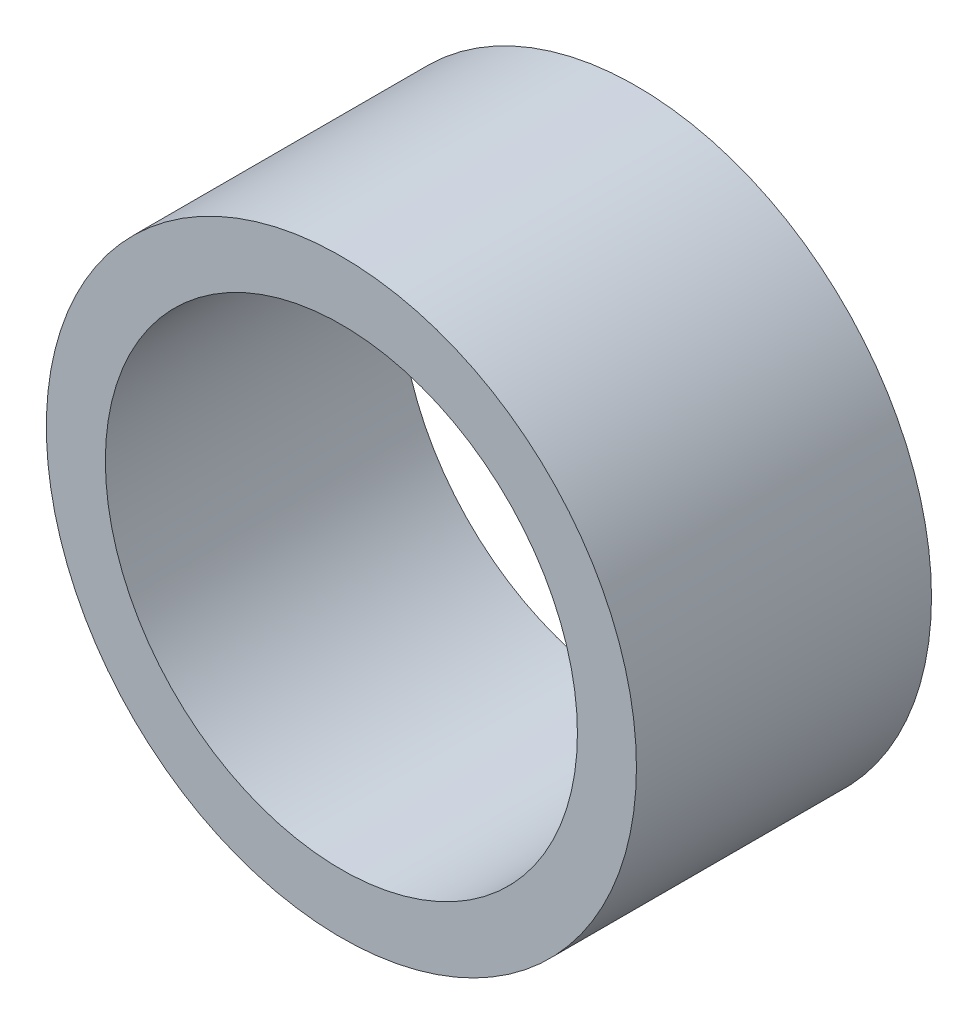
from build123d import *

# Parameters (mm, degrees)
SKETCH1_R           = 12.7
SKETCH1_R_2         = 10.16
BOSS_EXTRUDE1_DEPTH = 12.7


with BuildPart() as part:
    # Sketch1 → Boss-Extrude1 (new body)
    with BuildSketch(Plane.XY):
        Circle(SKETCH1_R)
        Circle(SKETCH1_R_2, mode=Mode.SUBTRACT)
    extrude(amount=BOSS_EXTRUDE1_DEPTH)


solid = part.part
